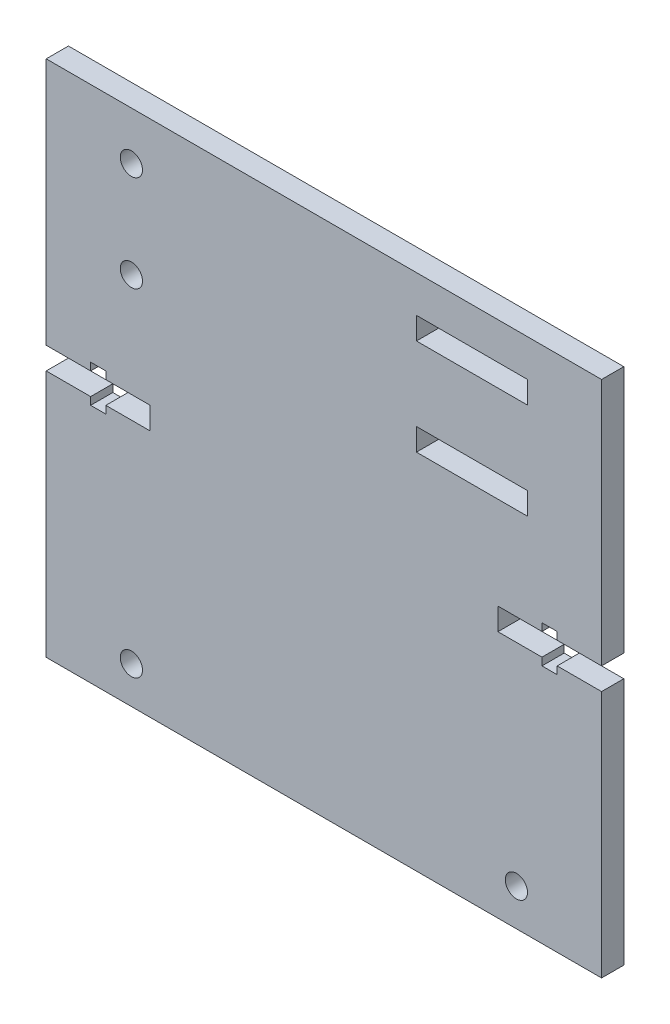
from build123d import *

# Parameters (mm, degrees)
ESQUISSE1_W                  = 75
ESQUISSE1_H                  = 70
ESQUISSE1_R                  = 1.5
ESQUISSE1_W_2                = 15
ESQUISSE1_H_2                = 3
BOSS_EXTRU_1_DEPTH           = 3
ENL_V_MAT_EXTRU_1_DEPTH      = 10
ENL_V_MAT_EXTRU_1_DEPTH_BACK = 10


with BuildPart() as part:
    # Esquisse1 → Boss.-Extru.1 (new body)
    with BuildSketch(Plane.XY):
        with Locations((-12.683673469, -2.836734694)):
            Rectangle(ESQUISSE1_W, ESQUISSE1_H)
        with Locations((-38.683673469, 25.663265306)):
            Circle(ESQUISSE1_R, mode=Mode.SUBTRACT)
        with Locations((-38.683673469, 12.663265306)):
            Circle(ESQUISSE1_R, mode=Mode.SUBTRACT)
        with Locations((-38.683673469, -32.836734694)):
            Circle(ESQUISSE1_R, mode=Mode.SUBTRACT)
        with Locations((13.316326531, -32.836734694)):
            Circle(ESQUISSE1_R, mode=Mode.SUBTRACT)
        with Locations((7.316326531, 12.663265306)):
            Rectangle(ESQUISSE1_W_2, ESQUISSE1_H_2, mode=Mode.SUBTRACT)
        with Locations((7.316326531, 25.663265306)):
            Rectangle(ESQUISSE1_W_2, ESQUISSE1_H_2, mode=Mode.SUBTRACT)
    extrude(amount=BOSS_EXTRU_1_DEPTH)

    # Esquisse2 → Enlèv. mat.-Extru.1 (cut, two sides: drawn at the far end of the back side and taken through both)
    with BuildSketch(Plane.XY.offset(-ENL_V_MAT_EXTRU_1_DEPTH_BACK)):
        Polygon((24.816326531, -1.336734694), (18.816326531, -1.336734694), (18.816326531, -0.311734694), (16.766326531, -0.311734694), (16.766326531, -1.336734694), (10.816326531, -1.336734694), (10.816326531, -4.336734694), (16.766326531, -4.336734694), (16.766326531, -5.361734694), (18.816326531, -5.361734694), (18.816326531, -4.336734694), (24.816326531, -4.336734694), align=None)
        Polygon((-50.183673469, -1.336734694), (-50.183673469, -4.336734694), (-44.183673469, -4.336734694), (-44.183673469, -5.361734694), (-42.133673469, -5.361734694), (-42.133673469, -4.336734694), (-36.183673469, -4.336734694), (-36.183673469, -1.336734694), (-42.133673469, -1.336734694), (-42.133673469, -0.311734694), (-44.183673469, -0.311734694), (-44.183673469, -1.336734694), align=None)
    extrude(amount=ENL_V_MAT_EXTRU_1_DEPTH + ENL_V_MAT_EXTRU_1_DEPTH_BACK, mode=Mode.SUBTRACT)


solid = part.part
